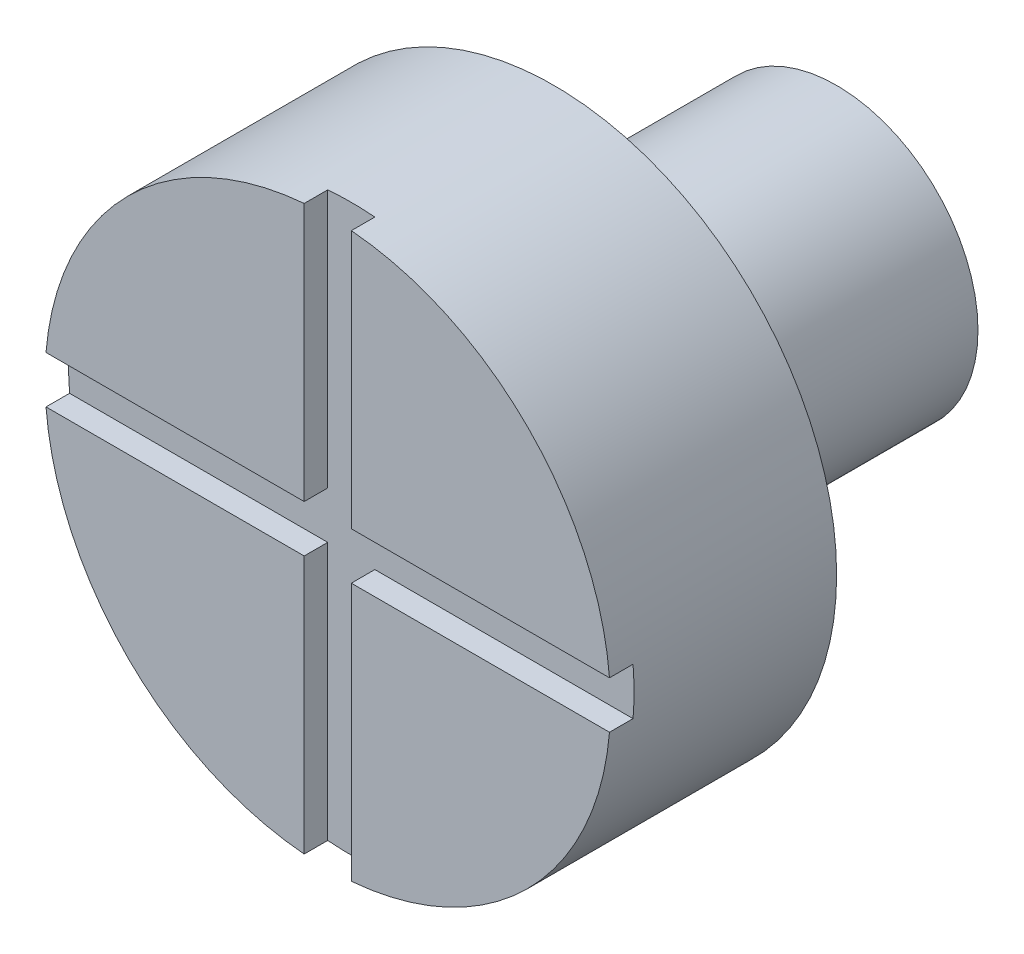
from build123d import *

# Parameters (mm, degrees)
CUT_EXTRUDE1_DEPTH = 0.25


with BuildPart() as part:
    # Sketch1 → Revolve1 (revolve)
    with BuildSketch(Plane(origin=(0, 0, 0), x_dir=(0, 0, -1), z_dir=(1, 0, 0)), mode=Mode.PRIVATE) as revolve1_sk:
        Polygon((0, 0), (0, 3), (2.4, 3), (2.4, 1.5), (5.4, 1.5), (5.4, 0), align=None)
    revolve(revolve1_sk.sketch.rotate(Axis((0, 0, 0), (0, 0, -1)), 90), axis=Axis((0, 0, 0), (0, 0, -1)))

    # Sketch2 → Cut-Extrude1 (cut)
    with BuildSketch(Plane.XY):
        Polygon((-0.25, 3), (-0.25, 0.25), (-3, 0.25), (-3.446498645, 0), (-3, -0.25), (-0.25, -0.25), (-0.25, -2), (-0.25, -3.474150095), (0.25, -3.474150095), (0.25, -2), (0.25, -0.25), (2, -0.25), (3.076862429, -0.25), (4.006902363, -0.319251284), (4.006902363, 0.25), (2, 0.25), (0.25, 0.25), (0.25, 3), (0, 3.446498645), align=None)
    extrude(amount=-CUT_EXTRUDE1_DEPTH, mode=Mode.SUBTRACT)


solid = part.part
